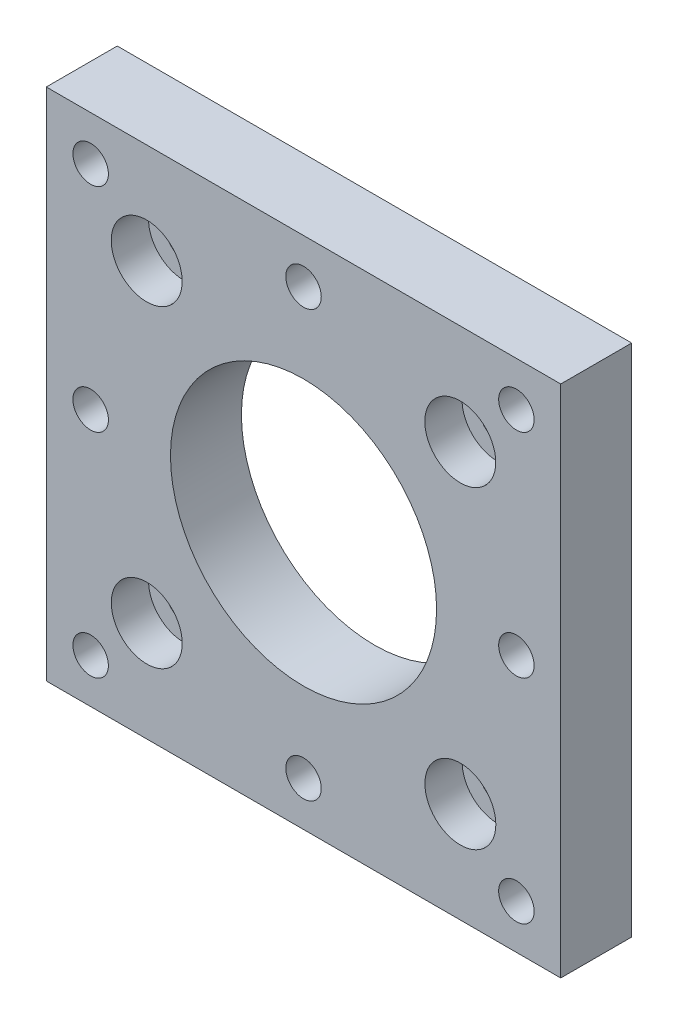
from build123d import *

# Parameters (mm, degrees)
SKETCH1_W           = 58
SKETCH1_H           = 58
SKETCH1_R           = 15
SKETCH1_R_2         = 2
BOSS_EXTRUDE1_DEPTH = 8
SKETCH3_R           = 2
CUT_EXTRUDE1_DEPTH  = 42.785164832
SKETCH4_R           = 4
CUT_EXTRUDE2_DEPTH  = 4.2


with BuildPart() as part:
    # Sketch1 → Boss-Extrude1 (new body)
    with BuildSketch(Plane.XY):
        Rectangle(SKETCH1_W, SKETCH1_H)
        Circle(SKETCH1_R, mode=Mode.SUBTRACT)
        with Locations((0, 24)):
            Circle(SKETCH1_R_2, mode=Mode.SUBTRACT)
        with Locations((-24, 24)):
            Circle(SKETCH1_R_2, mode=Mode.SUBTRACT)
        with Locations((24, 0)):
            Circle(SKETCH1_R_2, mode=Mode.SUBTRACT)
        with Locations((0, -24)):
            Circle(SKETCH1_R_2, mode=Mode.SUBTRACT)
        with Locations((-24, 0)):
            Circle(SKETCH1_R_2, mode=Mode.SUBTRACT)
        with Locations(Location((24, -24, 0), (0, 0, 180))):
            Circle(SKETCH1_R_2, mode=Mode.SUBTRACT)
        with Locations((24, 24)):
            Circle(SKETCH1_R_2, mode=Mode.SUBTRACT)
        with Locations(Location((-24, -24, 0), (0, 0, 180))):
            Circle(SKETCH1_R_2, mode=Mode.SUBTRACT)
    extrude(amount=BOSS_EXTRUDE1_DEPTH)

    # Sketch3 → Cut-Extrude1 (cut, through all)
    with BuildSketch(Plane(origin=(0, 0, 0), x_dir=(-1, 0, 0), z_dir=(0, 0, -1))):
        with Locations((-17.673408237, 17.681929795)):
            Circle(SKETCH3_R)
        with Locations((17.681929795, 17.673408237)):
            Circle(SKETCH3_R)
        with Locations((17.673408237, -17.681929795)):
            Circle(SKETCH3_R)
        with Locations((-17.681929795, -17.673408237)):
            Circle(SKETCH3_R)
    extrude(amount=-CUT_EXTRUDE1_DEPTH, mode=Mode.SUBTRACT)

    # Sketch4 → Cut-Extrude2 (cut)
    with BuildSketch(Plane.XY.offset(8)):
        with Locations((-17.681929795, 17.673408237)):
            Circle(SKETCH4_R)
        with Locations((17.673408237, 17.681929795)):
            Circle(SKETCH4_R)
        with Locations((17.681929795, -17.673408237)):
            Circle(SKETCH4_R)
        with Locations((-17.673408237, -17.681929795)):
            Circle(SKETCH4_R)
    extrude(amount=-CUT_EXTRUDE2_DEPTH, mode=Mode.SUBTRACT)


solid = part.part
